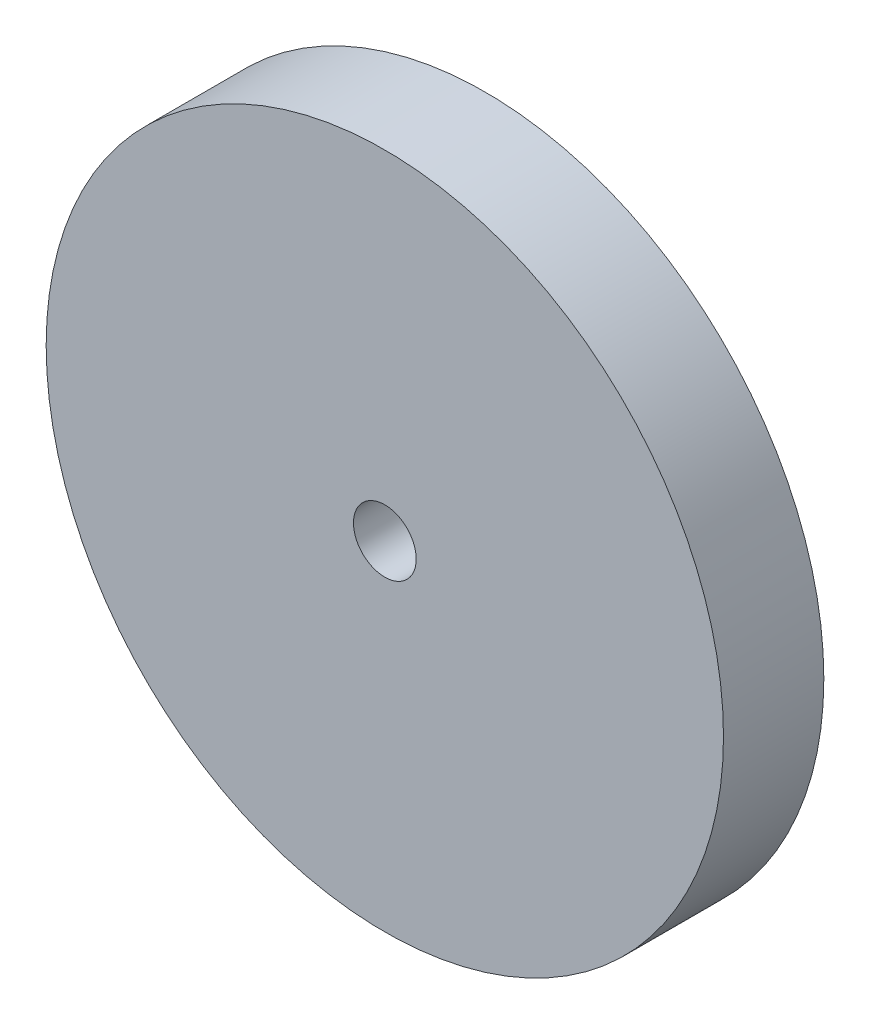
from build123d import *

# Parameters (mm, degrees)
SKETCH1_R           = 27
SKETCH1_R_2         = 2.5
BOSS_EXTRUDE1_DEPTH = 8


with BuildPart() as part:
    # Sketch1 → Boss-Extrude1 (new body)
    with BuildSketch(Plane.XY):
        Circle(SKETCH1_R)
        Circle(SKETCH1_R_2, mode=Mode.SUBTRACT)
    extrude(amount=BOSS_EXTRUDE1_DEPTH)


solid = part.part
